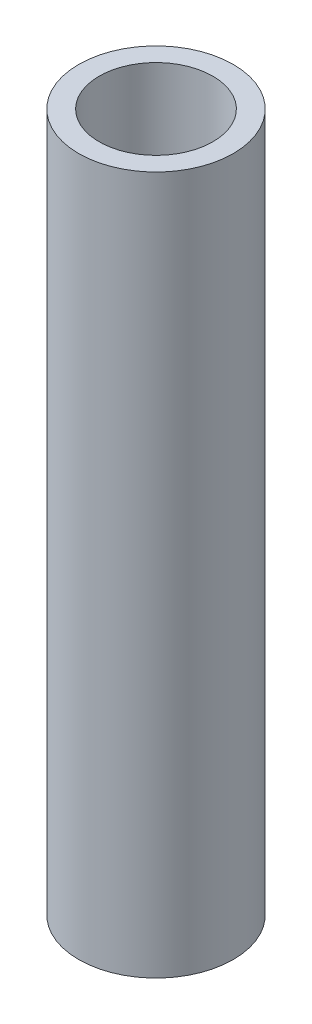
from build123d import *

# Parameters (mm, degrees)
SKETCH1_R           = 5.55625
SKETCH1_R_2         = 4.0894
BOSS_EXTRUDE1_DEPTH = 50.2


with BuildPart() as part:
    # Sketch1 → Boss-Extrude1 (new body)
    with BuildSketch(Plane(origin=(0, 0, 0), x_dir=(1, 0, 0), z_dir=(0, 1, 0))):
        with Locations(Location((0, 0, 0), (0, 0, 90))):
            Circle(SKETCH1_R)
        with Locations(Location((0, 0, 0), (0, 0, 90))):
            Circle(SKETCH1_R_2, mode=Mode.SUBTRACT)
    extrude(amount=BOSS_EXTRUDE1_DEPTH)


solid = part.part
